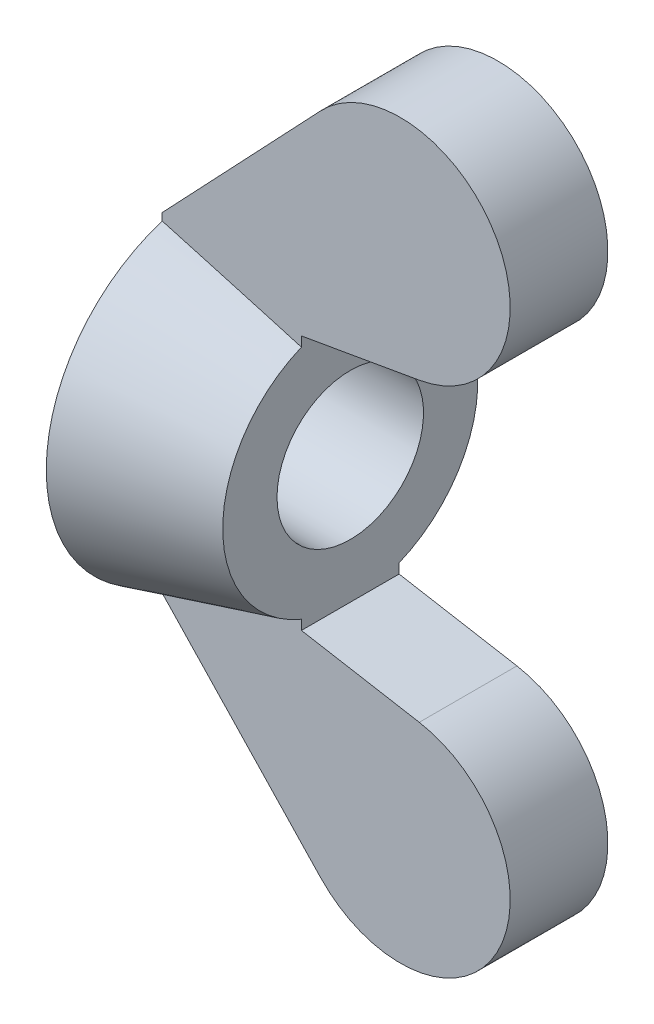
from build123d import *

# Parameters (mm, degrees)
BOSS_EXTRUDE1_DEPTH = 1.333333333


with BuildPart() as part:
    # Sketch2 → Revolve1 (revolve)
    with BuildSketch(Plane(origin=(0, 0, 0), x_dir=(1, 0, 0), z_dir=(0, 1, 0)), mode=Mode.PRIVATE) as revolve1_sk:
        Polygon((0, 2), (0, 4.5), (3.8, 3.481793069), (3.8, 2), align=None)
    revolve(revolve1_sk.sketch.rotate(Axis((0, 0, 0), (1, 0, 0)), 180), axis=Axis((0, 0, 0), (1, 0, 0)))

    # Sketch3 → Boss-Extrude1 (add, symmetric)
    with BuildSketch(Plane.XY):
        with BuildLine():
            Line((0, 4.5), (4.321922287, 9.063002054))
            ThreePointArc((4.321922287, 9.063002054), (9.142888967, 8.419555533), (7.017244249, 4.04492667))
            Line((7.017244249, 4.04492667), (3.8, 3.481793069))
            Line((3.8, 3.481793069), (3.8, 2))
            Line((3.8, 2), (0, 2))
            Line((0, 2), (0, 4.5))
        make_face()
    boss_extrude1 = extrude(amount=BOSS_EXTRUDE1_DEPTH, both=True)

    # Mirror1: Boss-Extrude1 across plane
    add(boss_extrude1.mirror(Plane.ZX))


solid = part.part
